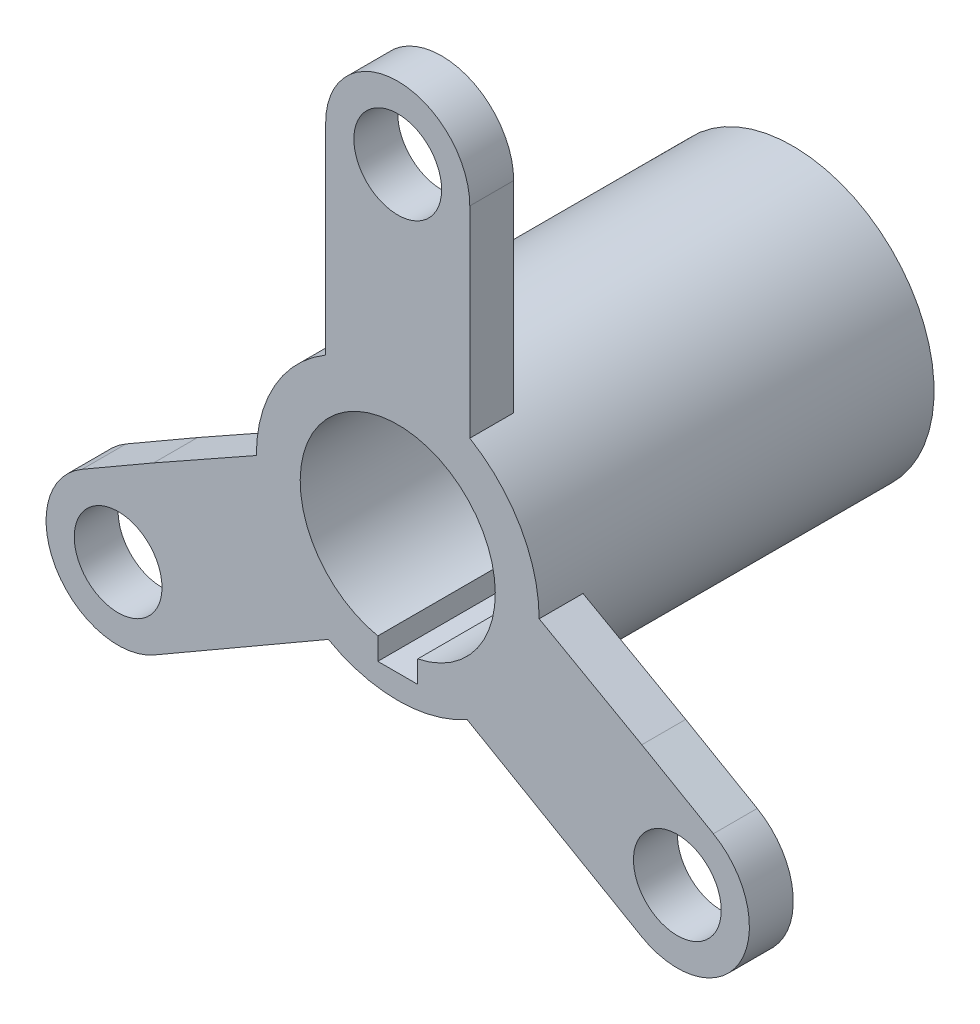
from build123d import *
from build123d.topology import SkipClean

# Parameters (mm, degrees)
SZKIC1_R                    = 5
SZKIC1_R_2                  = 11.115
DODANIE_WYCI_GNI_CIE1_DEPTH = 5
DODANIE_WYCI_GNI_CIE2_START = 40
SZKIC2_R                    = 16.115
SZKIC2_R_2                  = 11.115
DODANIE_WYCI_GNI_CIE2_DEPTH = 40
WYTNIJ_WYCI_GNI_CIE1_DEPTH  = 76.204328466
WYTNIJ_WYCI_GNI_CIE2_DEPTH  = 73.323516369


with BuildPart() as part:
    # Szkic1 → Dodanie-wyciągnięcie1 (new body)
    with BuildSketch(Plane.XY):
        with BuildLine():
            Line((35.966074605, -11.284931435), (27.812788277, -6.577629379))
            ThreePointArc((27.812788277, -6.577629379), (24.75100604, 14.29), (8.21, 27.375395888))
            Line((8.21, 27.375395888), (8.21, 36.79))
            ThreePointArc((8.21, 36.79), (0, 45), (-8.21, 36.79))
            Line((-8.21, 36.79), (-8.21, 27.375395888))
            ThreePointArc((-8.21, 27.375395888), (-24.75100604, 14.29), (-27.812788277, -6.577629379))
            Line((-27.812788277, -6.577629379), (-35.966074605, -11.284931435))
            ThreePointArc((-35.966074605, -11.284931435), (-38.97114317, -22.5), (-27.756074605, -25.505068565))
            Line((-27.756074605, -25.505068565), (-19.602788277, -20.797766509))
            ThreePointArc((-19.602788277, -20.797766509), (0, -28.58), (19.602788277, -20.797766509))
            Line((19.602788277, -20.797766509), (27.756074605, -25.505068565))
            ThreePointArc((27.756074605, -25.505068565), (38.97114317, -22.5), (35.966074605, -11.284931435))
        make_face()
        with Locations((0, 36.79)):
            Circle(SZKIC1_R, mode=Mode.SUBTRACT)
        with Locations((31.861074605, -18.395)):
            Circle(SZKIC1_R, mode=Mode.SUBTRACT)
        with Locations((-31.861074605, -18.395)):
            Circle(SZKIC1_R, mode=Mode.SUBTRACT)
        Circle(SZKIC1_R_2, mode=Mode.SUBTRACT)
    extrude(amount=DODANIE_WYCI_GNI_CIE1_DEPTH)

    # Szkic2 → Dodanie-wyciągnięcie2 (add)
    with SkipClean():  # the faces are left unmerged after this step: merging them gives an invalid solid
        with BuildSketch(Plane(origin=(0, 0, 0), x_dir=(-1, 0, 0), z_dir=(0, 0, -1)).offset(DODANIE_WYCI_GNI_CIE2_START)):
            with Locations(Location((0, 0, 0), (0, 0, 180))):
                Circle(SZKIC2_R)
            Circle(SZKIC2_R_2, mode=Mode.SUBTRACT)
        extrude(amount=-DODANIE_WYCI_GNI_CIE2_DEPTH)

    # Szkic3 → Wytnij-wyciągnięcie1 (cut, through all)
    with BuildSketch(Plane.XY.offset(5)):
        Polygon((2.27, -10.880731823), (2.27, -7.598635721), (-2.27, -7.598635721), (-2.27, -10.880731823), (-2.27, -13.39), (2.27, -13.39), align=None)
    extrude(amount=-WYTNIJ_WYCI_GNI_CIE1_DEPTH, mode=Mode.SUBTRACT)

    # Szkic4 → Wytnij-wyciągnięcie2 (cut, through all)
    with SkipClean():  # the faces are left unmerged after this step: merging them gives an invalid solid
        with BuildSketch(Plane(origin=(0, 0, 0), x_dir=(-1, 0, 0), z_dir=(0, 0, -1))):
            with BuildLine():
                Line((19.602788277, -20.797766509), (7.904031757, -14.043486283))
                ThreePointArc((7.904031757, -14.043486283), (0, -16.115), (-7.904031757, -14.043486283))
                Line((-7.904031757, -14.043486283), (-19.602788277, -20.797766509))
                ThreePointArc((-19.602788277, -20.797766509), (0, -28.58), (19.602788277, -20.797766509))
            make_face()
            with BuildLine():
                Line((27.812788277, -6.577629379), (16.115, 0))
                ThreePointArc((16.115, 0), (13.999953125, 7.980885759), (8.21, 13.866835436))
                Line((8.21, 13.866835436), (8.21, 27.375395888))
                ThreePointArc((8.21, 27.375395888), (24.75100604, 14.29), (27.812788277, -6.577629379))
            make_face()
            with BuildLine():
                Line((-8.21, 27.375395888), (-8.21, 13.866835436))
                ThreePointArc((-8.21, 13.866835436), (-13.999953125, 7.980885759), (-16.115, 0))
                Line((-16.115, 0), (-27.812788277, -6.577629379))
                ThreePointArc((-27.812788277, -6.577629379), (-24.75100604, 14.29), (-8.21, 27.375395888))
            make_face()
        extrude(amount=-WYTNIJ_WYCI_GNI_CIE2_DEPTH, mode=Mode.SUBTRACT)


solid = part.part
